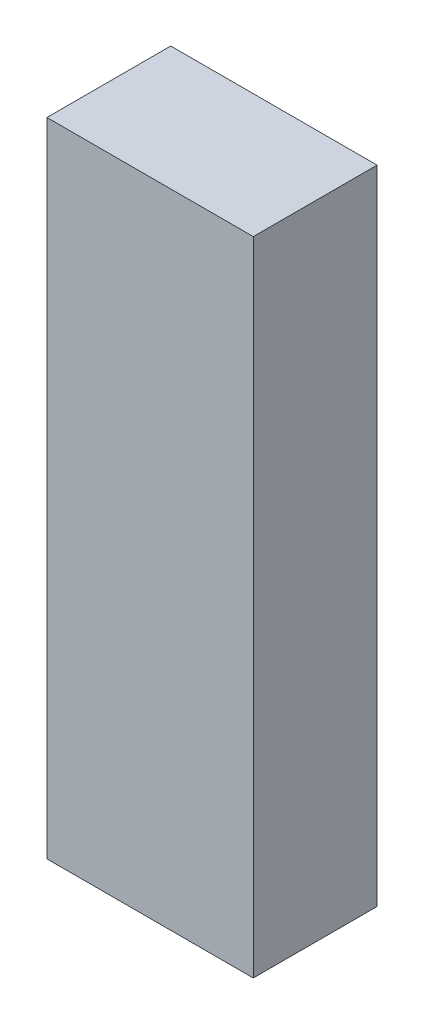
from build123d import *

# Parameters (mm, degrees)
SKETCH1_W           = 50.8
SKETCH1_H           = 158.072337674
BOSS_EXTRUDE1_DEPTH = 30.48


with BuildPart() as part:
    # Sketch1 → Boss-Extrude1 (new body)
    with BuildSketch(Plane.XY):
        Rectangle(SKETCH1_W, SKETCH1_H)
    extrude(amount=BOSS_EXTRUDE1_DEPTH)


solid = part.part
